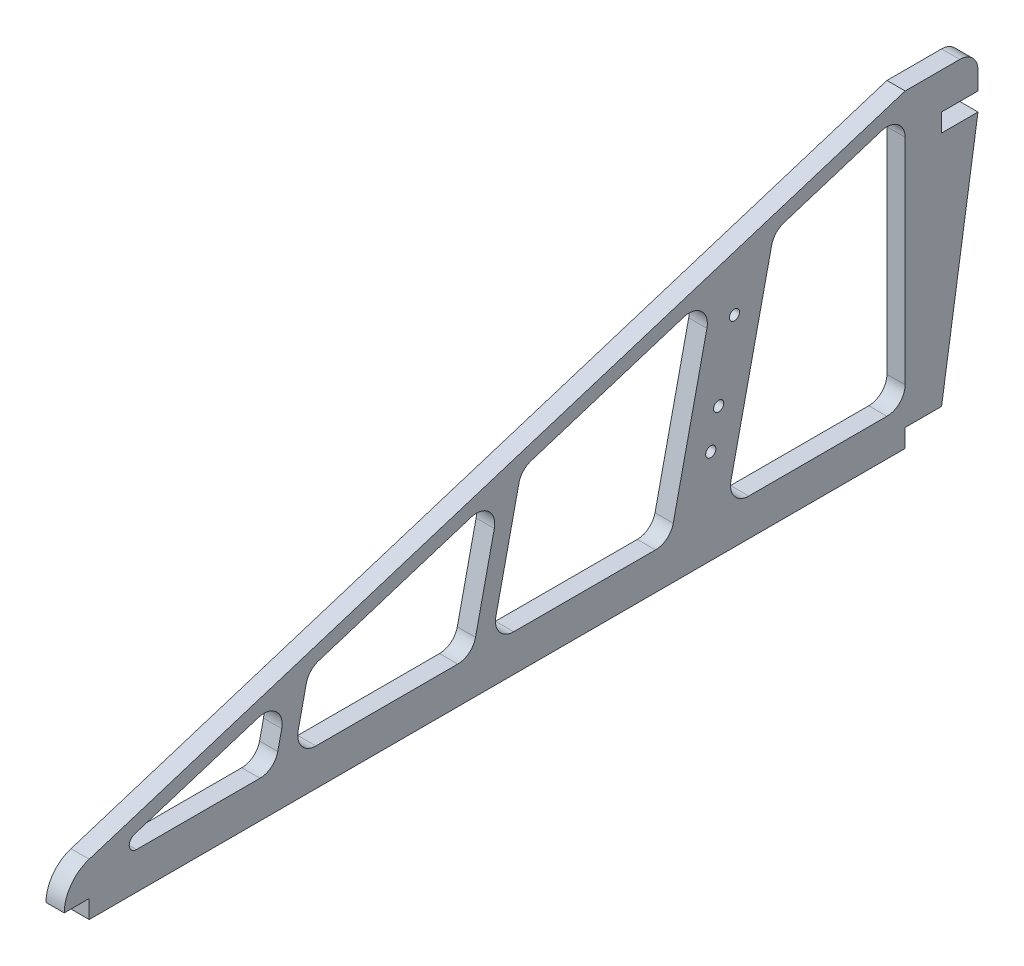
from build123d import *

# Parameters (mm, degrees)
BOSS_EXTRUDE1_DEPTH             = 3.175
CUT_EXTRUDE1_DEPTH              = 165.102970266
FILLET4_R                       = 3.175
FILLET5_R                       = 3.175
FILLET6_R                       = 3.175
FILLET7_R                       = 1.27
F_2_56_TAPPED_HOLE1_D           = 1.778
F_2_56_TAPPED_HOLE1_ON_FACE_2_D = 1.778


with BuildPart() as part:
    # Sketch1 → Boss-Extrude1 (new body)
    with BuildSketch(Plane(origin=(0, 0, 0), x_dir=(0, 0, -1), z_dir=(1, 0, 0))):
        with BuildLine():
            Line((0, 0), (142.24, 0))
            Line((142.24, 0), (142.24, 3.175))
            Line((142.24, 3.175), (148.59, 3.175))
            Line((148.59, 3.175), (154.94, 44.45))
            Line((154.94, 44.45), (148.59, 44.45))
            Line((148.59, 44.45), (148.59, 47.625))
            Line((148.59, 47.625), (154.94, 47.625))
            Line((154.94, 47.625), (154.94, 53.975))
            Line((154.94, 53.975), (142.24, 53.975))
            Line((142.24, 53.975), (0, 9.113473275))
            ThreePointArc((0, 9.113473275), (-3.148798139, 6.856769541), (-4.353876774, 3.175))
            Line((-4.353876774, 3.175), (0, 3.175))
            Line((0, 3.175), (0, 0))
        make_face()
    extrude(amount=BOSS_EXTRUDE1_DEPTH)

    # Sketch2 → Cut-Extrude1 (cut, through all)
    with BuildSketch(Plane(origin=(3.175, 0, 0), x_dir=(0, 0, -1), z_dir=(1, 0, 0))):
        Polygon((142.24, 6.450137188), (142.24, 51.311663913), (119.363152794, 44.096462195), (111.020554533, 6.450137188), align=None)
        Polygon((101.264477824, 6.450137188), (108.873959331, 40.788242054), (75.30854025, 30.201937603), (70.045032356, 6.450137188), align=None)
        Polygon((66.793006787, 6.450137188), (71.812142429, 29.099197556), (38.246723348, 18.512893105), (35.573561319, 6.450137188), align=None)
        Polygon((34.750325527, 17.410153058), (0, 6.450137188), (32.32153575, 6.450137188), align=None)
    extrude(amount=-CUT_EXTRUDE1_DEPTH, mode=Mode.SUBTRACT)

    # Fillet4
    fillet4_edges = [part.edges().sort_by_distance(p)[0] for p in [
        (1.5875, 6.450137188, -32.32153575),
        (1.5875, 6.450137188, -35.573561319),
        (1.5875, 6.450137188, -66.793006787),
        (1.5875, 6.450137188, -70.045032356),
        (1.5875, 6.450137188, -101.264477824),
        (1.5875, 6.450137188, -111.020554533),
        (1.5875, 6.450137188, -142.24),
        (1.5875, 18.512893105, -38.246723348),
        (1.5875, 30.201937603, -75.30854025),
        (1.5875, 44.096462195, -119.363152794),
    ]]
    fillet(fillet4_edges, radius=FILLET4_R)

    # Fillet5
    fillet5_edges = [part.edges().sort_by_distance(p)[0] for p in [
        (1.5875, 17.410153058, -34.750325527),
        (1.5875, 29.099197556, -71.812142429),
        (1.5875, 40.788242054, -108.873959331),
        (1.5875, 51.311663913, -142.24),
    ]]
    fillet(fillet5_edges, radius=FILLET5_R)

    # Fillet6
    fillet6_edges = [part.edges().sort_by_distance(p)[0] for p in [
        (1.5875, 53.975, -154.94),
    ]]
    fillet(fillet6_edges, radius=FILLET6_R)

    # Fillet7
    fillet7_edges = [part.edges().sort_by_distance(p)[0] for p in [
        (1.5875, 6.450137188, 0),
    ]]
    fillet(fillet7_edges, radius=FILLET7_R)

    # #2-56 Tapped Hole1 (through all)
    with Locations(Plane(origin=(3.175, 35.052107057, -112.480843865), x_dir=(0, 0, 1), z_dir=(1, 0, 0))):
        with Locations((0, 0), (2.747718528, 12.399195251), (4.121577793, 18.598792877)):
            Hole(F_2_56_TAPPED_HOLE1_D / 2)

    # #2-56 Tapped Hole1 on face 2 (through all)
    with Locations(Plane(origin=(524.251745337, 38.733811309, 0), x_dir=(0, 0, 1), z_dir=(1, 0, 0))):
        with Locations((0, 0)):
            Hole(F_2_56_TAPPED_HOLE1_ON_FACE_2_D / 2)


solid = part.part
